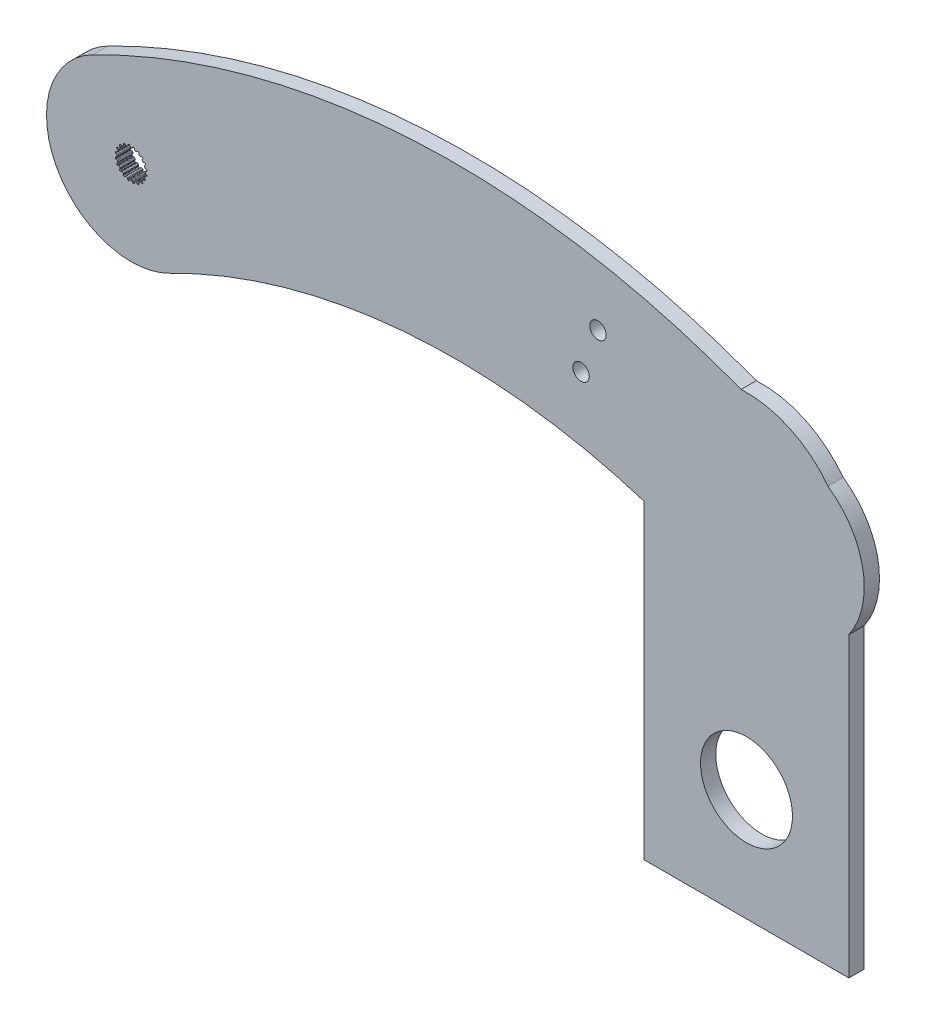
from build123d import *

# Parameters (mm, degrees)
BOSS_EXTRUDE1_DEPTH = 3.2004
SKETCH2_R           = 1.7272
SKETCH2_R_2         = 3.429
CUT_EXTRUDE1_DEPTH  = 3.2004
BOSS_EXTRUDE2_DEPTH = 3.2004
SKETCH4_R           = 9.661377141
CUT_EXTRUDE2_DEPTH  = 3.2004


with BuildPart() as part:
    # Sketch1 → Boss-Extrude1 (new body)
    with BuildSketch(Plane.XY):
        with BuildLine():
            ThreePointArc((-8.097097761, 15.832735205), (68.150612211, 34.198640293), (144.398322183, 15.832735205))
            ThreePointArc((144.398322183, 15.832735205), (152.133959628, -8.097097761), (128.204126662, -15.832735205))
            ThreePointArc((128.204126662, -15.832735205), (68.150612211, -1.367551307), (8.097097761, -15.832735205))
            ThreePointArc((8.097097761, -15.832735205), (-15.832735205, -8.097097761), (-8.097097761, 15.832735205))
        make_face()
        with BuildLine():
            Line((-0.106949245, 2.969874934), (0.106949245, 2.969874934))
            ThreePointArc((0.106949245, 2.969874934), (0.196343213, 2.986924176), (0.253739238, 3.057547504))
            Line((0.253739238, 3.057547504), (0.315888147, 3.237526941))
            ThreePointArc((0.315888147, 3.237526941), (0.359032156, 3.298322911), (0.4281449, 3.326269005))
            Line((0.4281449, 3.326269005), (0.620027588, 3.2937547))
            ThreePointArc((0.620027588, 3.2937547), (0.689621142, 3.24802576), (0.718272212, 3.169836791))
            Line((0.718272212, 3.169836791), (0.724389167, 2.979527391))
            ThreePointArc((0.724389167, 2.979527391), (0.750934762, 2.9040661), (0.816027049, 2.857568043))
            Line((0.816027049, 2.857568043), (1.019456602, 2.791469774))
            ThreePointArc((1.019456602, 2.791469774), (1.109743823, 2.780060312), (1.186154496, 2.829490741))
            Line((1.186154496, 2.829490741), (1.300878326, 2.981456288))
            ThreePointArc((1.300878326, 2.981456288), (1.360697704, 3.02594446), (1.435063648, 3.031165762))
            Line((1.435063648, 3.031165762), (1.607507455, 2.940947809))
            ThreePointArc((1.607507455, 2.940947809), (1.659563839, 2.875951412), (1.662650905, 2.792735615))
            Line((1.662650905, 2.792735615), (1.609659636, 2.609850378))
            ThreePointArc((1.609659636, 2.609850378), (1.611587176, 2.529879385), (1.659124931, 2.465542482))
            Line((1.659124931, 2.465542482), (1.832172444, 2.339816104))
            ThreePointArc((1.832172444, 2.339816104), (1.914514976, 2.301064775), (2.002460687, 2.32446371))
            Line((2.002460687, 2.32446371), (2.158529469, 2.433539921))
            ThreePointArc((2.158529469, 2.433539921), (2.229168681, 2.457365482), (2.301508367, 2.439350895))
            Line((2.301508367, 2.439350895), (2.437633293, 2.300260456))
            ThreePointArc((2.437633293, 2.300260456), (2.467056864, 2.222358901), (2.444277744, 2.14226202))
            Line((2.444277744, 2.14226202), (2.337365406, 1.984703026))
            ThreePointArc((2.337365406, 1.984703026), (2.314486209, 1.908050449), (2.339816104, 1.832172444))
            Line((2.339816104, 1.832172444), (2.465542482, 1.659124931))
            ThreePointArc((2.465542482, 1.659124931), (2.531880064, 1.596824985), (2.622752074, 1.591901975))
            Line((2.622752074, 1.591901975), (2.804888709, 1.64741171))
            ThreePointArc((2.804888709, 1.64741171), (2.879433095, 1.648242449), (2.942665411, 1.608755366))
            Line((2.942665411, 1.608755366), (3.0291466, 1.434407582))
            ThreePointArc((3.0291466, 1.434407582), (3.033057175, 1.351226417), (2.986641646, 1.282088892))
            Line((2.986641646, 1.282088892), (2.836273564, 1.165279113))
            ThreePointArc((2.836273564, 1.165279113), (2.790827206, 1.099448241), (2.791469774, 1.019456602))
            Line((2.791469774, 1.019456602), (2.857568043, 0.816027049))
            ThreePointArc((2.857568043, 0.816027049), (2.901407091, 0.736276839), (2.986310214, 0.703513784))
            Line((2.986310214, 0.703513784), (3.1766859, 0.700023363))
            ThreePointArc((3.1766859, 0.700023363), (3.247838536, 0.677777961), (3.295773863, 0.620683653))
            Line((3.295773863, 0.620683653), (3.324145932, 0.4281449))
            ThreePointArc((3.324145932, 0.4281449), (3.302160717, 0.347826477), (3.236652255, 0.29641597))
            Line((3.236652255, 0.29641597), (3.057547504, 0.231789562))
            ThreePointArc((3.057547504, 0.231789562), (2.993982591, 0.183224379), (2.969874934, 0.106949245))
            Line((2.969874934, 0.106949245), (2.969874934, -0.106949245))
            ThreePointArc((2.969874934, -0.106949245), (2.986924176, -0.196343213), (3.057547504, -0.253739238))
            Line((3.057547504, -0.253739238), (3.237526941, -0.315888147))
            ThreePointArc((3.237526941, -0.315888147), (3.298322911, -0.359032156), (3.326269005, -0.4281449))
            Line((3.326269005, -0.4281449), (3.2937547, -0.620027588))
            ThreePointArc((3.2937547, -0.620027588), (3.24802576, -0.689621142), (3.169836791, -0.718272212))
            Line((3.169836791, -0.718272212), (2.979527391, -0.724389167))
            ThreePointArc((2.979527391, -0.724389167), (2.9040661, -0.750934762), (2.857568043, -0.816027049))
            Line((2.857568043, -0.816027049), (2.791469774, -1.019456602))
            ThreePointArc((2.791469774, -1.019456602), (2.780060312, -1.109743823), (2.829490741, -1.186154496))
            Line((2.829490741, -1.186154496), (2.981456288, -1.300878326))
            ThreePointArc((2.981456288, -1.300878326), (3.02594446, -1.360697704), (3.031165762, -1.435063648))
            Line((3.031165762, -1.435063648), (2.940947809, -1.607507455))
            ThreePointArc((2.940947809, -1.607507455), (2.875951412, -1.659563839), (2.792735615, -1.662650905))
            Line((2.792735615, -1.662650905), (2.609850378, -1.609659636))
            ThreePointArc((2.609850378, -1.609659636), (2.529879385, -1.611587176), (2.465542482, -1.659124931))
            Line((2.465542482, -1.659124931), (2.339816104, -1.832172444))
            ThreePointArc((2.339816104, -1.832172444), (2.301064775, -1.914514976), (2.32446371, -2.002460687))
            Line((2.32446371, -2.002460687), (2.433539921, -2.158529469))
            ThreePointArc((2.433539921, -2.158529469), (2.457365482, -2.229168681), (2.439350895, -2.301508367))
            Line((2.439350895, -2.301508367), (2.300260456, -2.437633293))
            ThreePointArc((2.300260456, -2.437633293), (2.222358901, -2.467056864), (2.14226202, -2.444277744))
            Line((2.14226202, -2.444277744), (1.984703026, -2.337365406))
            ThreePointArc((1.984703026, -2.337365406), (1.908050449, -2.314486209), (1.832172444, -2.339816104))
            Line((1.832172444, -2.339816104), (1.659124931, -2.465542482))
            ThreePointArc((1.659124931, -2.465542482), (1.596824985, -2.531880064), (1.591901975, -2.622752074))
            Line((1.591901975, -2.622752074), (1.64741171, -2.804888709))
            ThreePointArc((1.64741171, -2.804888709), (1.648242449, -2.879433095), (1.608755366, -2.942665411))
            Line((1.608755366, -2.942665411), (1.434407582, -3.0291466))
            ThreePointArc((1.434407582, -3.0291466), (1.351226417, -3.033057175), (1.282088892, -2.986641646))
            Line((1.282088892, -2.986641646), (1.165279113, -2.836273564))
            ThreePointArc((1.165279113, -2.836273564), (1.099448241, -2.790827206), (1.019456602, -2.791469774))
            Line((1.019456602, -2.791469774), (0.816027049, -2.857568043))
            ThreePointArc((0.816027049, -2.857568043), (0.736276839, -2.901407091), (0.703513784, -2.986310214))
            Line((0.703513784, -2.986310214), (0.700023363, -3.1766859))
            ThreePointArc((0.700023363, -3.1766859), (0.677777961, -3.247838536), (0.620683653, -3.295773863))
            Line((0.620683653, -3.295773863), (0.4281449, -3.324145932))
            ThreePointArc((0.4281449, -3.324145932), (0.347826477, -3.302160717), (0.29641597, -3.236652255))
            Line((0.29641597, -3.236652255), (0.231789562, -3.057547504))
            ThreePointArc((0.231789562, -3.057547504), (0.183224379, -2.993982591), (0.106949245, -2.969874934))
            Line((0.106949245, -2.969874934), (-0.106949245, -2.969874934))
            ThreePointArc((-0.106949245, -2.969874934), (-0.196343213, -2.986924176), (-0.253739238, -3.057547504))
            Line((-0.253739238, -3.057547504), (-0.315888147, -3.237526941))
            ThreePointArc((-0.315888147, -3.237526941), (-0.359032156, -3.298322911), (-0.4281449, -3.326269005))
            Line((-0.4281449, -3.326269005), (-0.620027588, -3.2937547))
            ThreePointArc((-0.620027588, -3.2937547), (-0.689621142, -3.24802576), (-0.718272212, -3.169836791))
            Line((-0.718272212, -3.169836791), (-0.724389167, -2.979527391))
            ThreePointArc((-0.724389167, -2.979527391), (-0.750934762, -2.9040661), (-0.816027049, -2.857568043))
            Line((-0.816027049, -2.857568043), (-1.019456602, -2.791469774))
            ThreePointArc((-1.019456602, -2.791469774), (-1.109743823, -2.780060312), (-1.186154496, -2.829490741))
            Line((-1.186154496, -2.829490741), (-1.300878326, -2.981456288))
            ThreePointArc((-1.300878326, -2.981456288), (-1.360697704, -3.02594446), (-1.435063648, -3.031165762))
            Line((-1.435063648, -3.031165762), (-1.607507455, -2.940947809))
            ThreePointArc((-1.607507455, -2.940947809), (-1.659563839, -2.875951412), (-1.662650905, -2.792735615))
            Line((-1.662650905, -2.792735615), (-1.609659636, -2.609850378))
            ThreePointArc((-1.609659636, -2.609850378), (-1.611587176, -2.529879385), (-1.659124931, -2.465542482))
            Line((-1.659124931, -2.465542482), (-1.832172444, -2.339816104))
            ThreePointArc((-1.832172444, -2.339816104), (-1.914514976, -2.301064775), (-2.002460687, -2.32446371))
            Line((-2.002460687, -2.32446371), (-2.158529469, -2.433539921))
            ThreePointArc((-2.158529469, -2.433539921), (-2.229168681, -2.457365482), (-2.301508367, -2.439350895))
            Line((-2.301508367, -2.439350895), (-2.437633293, -2.300260456))
            ThreePointArc((-2.437633293, -2.300260456), (-2.467056864, -2.222358901), (-2.444277744, -2.14226202))
            Line((-2.444277744, -2.14226202), (-2.337365406, -1.984703026))
            ThreePointArc((-2.337365406, -1.984703026), (-2.314486209, -1.908050449), (-2.339816104, -1.832172444))
            Line((-2.339816104, -1.832172444), (-2.465542482, -1.659124931))
            ThreePointArc((-2.465542482, -1.659124931), (-2.531880064, -1.596824985), (-2.622752074, -1.591901975))
            Line((-2.622752074, -1.591901975), (-2.804888709, -1.64741171))
            ThreePointArc((-2.804888709, -1.64741171), (-2.879433095, -1.648242449), (-2.942665411, -1.608755366))
            Line((-2.942665411, -1.608755366), (-3.0291466, -1.434407582))
            ThreePointArc((-3.0291466, -1.434407582), (-3.033057175, -1.351226417), (-2.986641646, -1.282088892))
            Line((-2.986641646, -1.282088892), (-2.836273564, -1.165279113))
            ThreePointArc((-2.836273564, -1.165279113), (-2.790827206, -1.099448241), (-2.791469774, -1.019456602))
            Line((-2.791469774, -1.019456602), (-2.857568043, -0.816027049))
            ThreePointArc((-2.857568043, -0.816027049), (-2.901407091, -0.736276839), (-2.986310214, -0.703513784))
            Line((-2.986310214, -0.703513784), (-3.1766859, -0.700023363))
            ThreePointArc((-3.1766859, -0.700023363), (-3.247838536, -0.677777961), (-3.295773863, -0.620683653))
            Line((-3.295773863, -0.620683653), (-3.324145932, -0.4281449))
            ThreePointArc((-3.324145932, -0.4281449), (-3.302160717, -0.347826477), (-3.236652255, -0.29641597))
            Line((-3.236652255, -0.29641597), (-3.057547504, -0.231789562))
            ThreePointArc((-3.057547504, -0.231789562), (-2.993982591, -0.183224379), (-2.969874934, -0.106949245))
            Line((-2.969874934, -0.106949245), (-2.969874934, 0.106949245))
            ThreePointArc((-2.969874934, 0.106949245), (-2.986924176, 0.196343213), (-3.057547504, 0.253739238))
            Line((-3.057547504, 0.253739238), (-3.237526941, 0.315888147))
            ThreePointArc((-3.237526941, 0.315888147), (-3.298322911, 0.359032156), (-3.326269005, 0.4281449))
            Line((-3.326269005, 0.4281449), (-3.2937547, 0.620027588))
            ThreePointArc((-3.2937547, 0.620027588), (-3.24802576, 0.689621142), (-3.169836791, 0.718272212))
            Line((-3.169836791, 0.718272212), (-2.979527391, 0.724389167))
            ThreePointArc((-2.979527391, 0.724389167), (-2.9040661, 0.750934762), (-2.857568043, 0.816027049))
            Line((-2.857568043, 0.816027049), (-2.791469774, 1.019456602))
            ThreePointArc((-2.791469774, 1.019456602), (-2.780060312, 1.109743823), (-2.829490741, 1.186154496))
            Line((-2.829490741, 1.186154496), (-2.981456288, 1.300878326))
            ThreePointArc((-2.981456288, 1.300878326), (-3.02594446, 1.360697704), (-3.031165762, 1.435063648))
            Line((-3.031165762, 1.435063648), (-2.940947809, 1.607507455))
            ThreePointArc((-2.940947809, 1.607507455), (-2.875951412, 1.659563839), (-2.792735615, 1.662650905))
            Line((-2.792735615, 1.662650905), (-2.609850378, 1.609659636))
            ThreePointArc((-2.609850378, 1.609659636), (-2.529879385, 1.611587176), (-2.465542482, 1.659124931))
            Line((-2.465542482, 1.659124931), (-2.339816104, 1.832172444))
            ThreePointArc((-2.339816104, 1.832172444), (-2.301064775, 1.914514976), (-2.32446371, 2.002460687))
            Line((-2.32446371, 2.002460687), (-2.433539921, 2.158529469))
            ThreePointArc((-2.433539921, 2.158529469), (-2.457365482, 2.229168681), (-2.439350895, 2.301508367))
            Line((-2.439350895, 2.301508367), (-2.300260456, 2.437633293))
            ThreePointArc((-2.300260456, 2.437633293), (-2.222358901, 2.467056864), (-2.14226202, 2.444277744))
            Line((-2.14226202, 2.444277744), (-1.984703026, 2.337365406))
            ThreePointArc((-1.984703026, 2.337365406), (-1.908050449, 2.314486209), (-1.832172444, 2.339816104))
            Line((-1.832172444, 2.339816104), (-1.659124931, 2.465542482))
            ThreePointArc((-1.659124931, 2.465542482), (-1.596824985, 2.531880064), (-1.591901975, 2.622752074))
            Line((-1.591901975, 2.622752074), (-1.64741171, 2.804888709))
            ThreePointArc((-1.64741171, 2.804888709), (-1.648242449, 2.879433095), (-1.608755366, 2.942665411))
            Line((-1.608755366, 2.942665411), (-1.434407582, 3.0291466))
            ThreePointArc((-1.434407582, 3.0291466), (-1.351226417, 3.033057175), (-1.282088892, 2.986641646))
            Line((-1.282088892, 2.986641646), (-1.165279113, 2.836273564))
            ThreePointArc((-1.165279113, 2.836273564), (-1.099448241, 2.790827206), (-1.019456602, 2.791469774))
            Line((-1.019456602, 2.791469774), (-0.816027049, 2.857568043))
            ThreePointArc((-0.816027049, 2.857568043), (-0.736276839, 2.901407091), (-0.703513784, 2.986310214))
            Line((-0.703513784, 2.986310214), (-0.700023363, 3.1766859))
            ThreePointArc((-0.700023363, 3.1766859), (-0.677777961, 3.247838536), (-0.620683653, 3.295773863))
            Line((-0.620683653, 3.295773863), (-0.4281449, 3.324145932))
            ThreePointArc((-0.4281449, 3.324145932), (-0.347826477, 3.302160717), (-0.29641597, 3.236652255))
            Line((-0.29641597, 3.236652255), (-0.231789562, 3.057547504))
            ThreePointArc((-0.231789562, 3.057547504), (-0.183224379, 2.993982591), (-0.106949245, 2.969874934))
        make_face(mode=Mode.SUBTRACT)
    extrude(amount=BOSS_EXTRUDE1_DEPTH)

    # Sketch2 → Cut-Extrude1 (cut)
    with BuildSketch(Plane.XY.offset(3.2004)):
        with Locations((98.116629493, 18.798132595)):
            Circle(SKETCH2_R)
        with Locations((141.772354719, -8.486069163)):
            Circle(SKETCH2_R)
        with Locations((145.324076023, 0.861940095)):
            Circle(SKETCH2_R)
        with Locations((94.564908189, 9.450123336)):
            Circle(SKETCH2_R)
        with Locations((129.33643692, 1.587617355)):
            Circle(SKETCH2_R_2)
    extrude(amount=-CUT_EXTRUDE1_DEPTH, mode=Mode.SUBTRACT)

    # Sketch3 → Boss-Extrude2 (add)
    with BuildSketch(Plane.XY.offset(3.2004)):
        with BuildLine():
            Line((150.846082742, 1.587617355), (150.846082742, -72.731838523))
            Line((150.846082742, -72.731838523), (107.826791097, -72.731838523))
            Line((107.826791097, -72.731838523), (107.826791097, 1.587617355))
            ThreePointArc((107.826791097, 1.587617355), (129.33643692, 23.097263178), (150.846082742, 1.587617355))
        make_face()
    extrude(amount=-BOSS_EXTRUDE2_DEPTH)

    # Sketch4 → Cut-Extrude2 (cut)
    with BuildSketch(Plane.XY.offset(3.2004)):
        with Locations((129.33643692, -49.212382645)):
            Circle(SKETCH4_R)
    extrude(amount=-CUT_EXTRUDE2_DEPTH, mode=Mode.SUBTRACT)


solid = part.part
